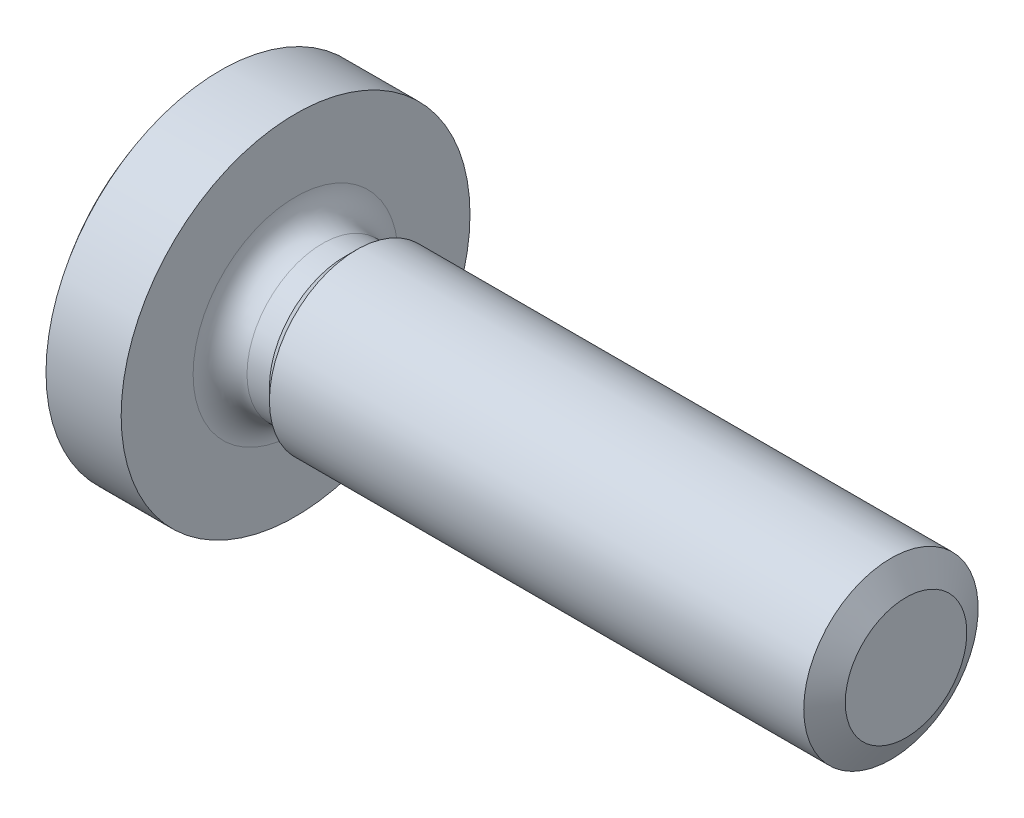
from build123d import *


with BuildPart() as part:
    # 草图2 → Revolve 706 (revolve)
    with BuildSketch(Plane.XY, mode=Mode.PRIVATE) as revolve_706_sk:
        with BuildLine():
            Line((0, 0), (17.1, 0))
            Line((17.1, 0), (17.1, 2))
            Line((17.1, 2), (4.5, 2))
            Line((4.5, 2), (4.232, 1.732))
            Line((4.232, 1.732), (3.718, 1.732))
            ThreePointArc((3.718, 1.732), (3.281008009, 1.913008009), (3.1, 2.35))
            Line((3.1, 2.35), (3.1, 4))
            Line((3.1, 4), (1.376524617, 4))
            ThreePointArc((1.376524617, 4), (0.353757652, 2.115113473), (0, 0))
        make_face()
    revolve(revolve_706_sk.sketch.rotate(Axis((-1.331757704, 0, 0), (1, 0, 0)), 90), axis=Axis((-1.331757704, 0, 0), (1, 0, 0)))

    # 草图3 → 切除-旋转1 (revolve, cut)
    with BuildSketch(Plane.XY, mode=Mode.PRIVATE) as cut_revolve_1_sk:
        Polygon((16.753791204, 2), (17.453791204, 2), (17.1, 1.3938), align=None)
    revolve(cut_revolve_1_sk.sketch.rotate(Axis((-0.242766179, 0, 0), (1, 0, 0)), 90), axis=Axis((-0.242766179, 0, 0), (1, 0, 0)), mode=Mode.SUBTRACT)

    # 草图5 → 切除-放样1 section 0
    with BuildSketch(Plane(origin=(0, 0, 0), x_dir=(0, 0, -1), z_dir=(1, 0, 0)), mode=Mode.PRIVATE) as loft_1_s0:
        with BuildLine():
            Line((0.35, 2.2), (-0.35, 2.2))
            Line((-0.35, 2.2), (-0.35, -2.2))
            Line((-0.35, -2.2), (0.35, -2.2))
            Line((0.35, -2.2), (0.35, 2.2))
        make_face()
    loft_1 = loft([Vertex(2.4, 0, 0), loft_1_s0.sketch], mode=Mode.SUBTRACT)

    # 镜向1: 切除-放样1 across plane
    add(loft_1.mirror(Plane(origin=(0, 0, 0), x_dir=(0, 0.7071067811865462, 0.7071067811865488), z_dir=(0, -0.7071067811865488, 0.7071067811865462))), mode=Mode.SUBTRACT)


solid = part.part
